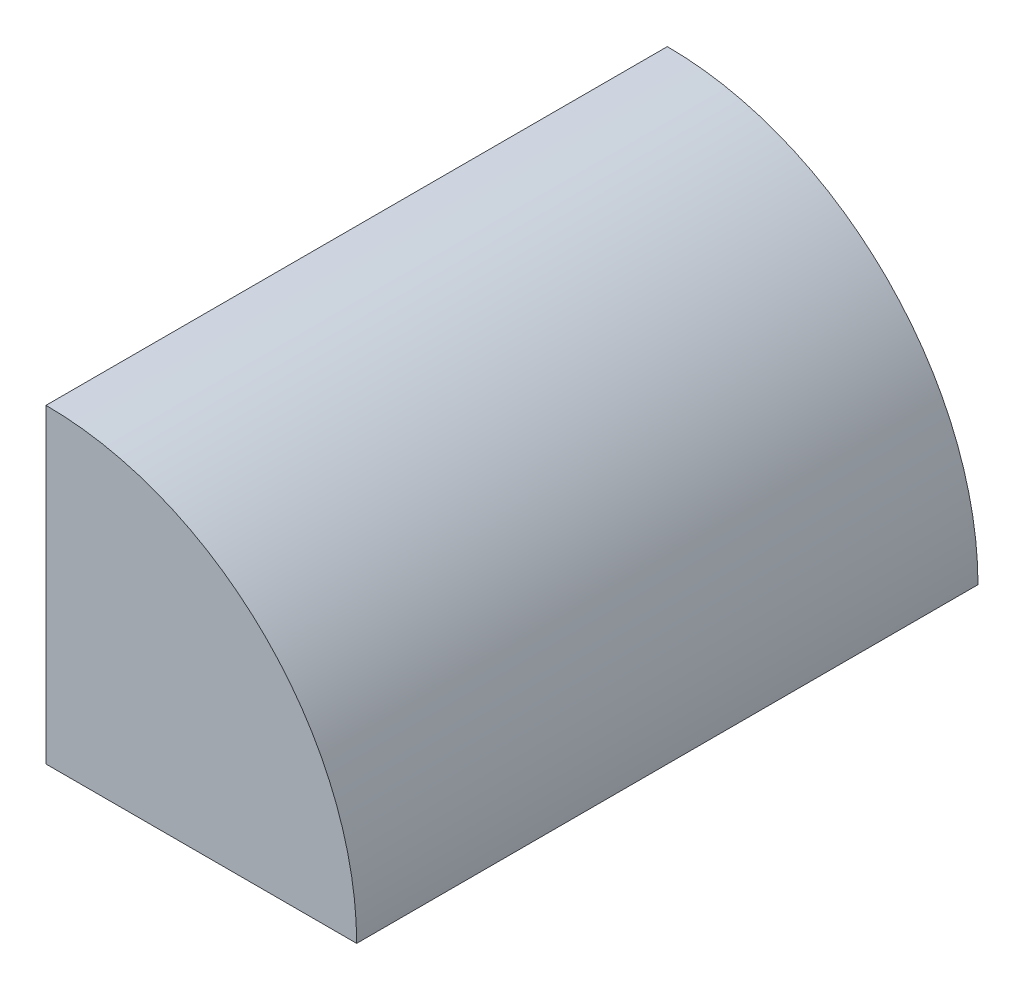
from build123d import *

# Parameters (mm, degrees)
SALIENTE_EXTRUIR1_DEPTH = 50
CROQUIS2_R              = 5
CORTAR_EXTRUIR1_DEPTH   = 10


with BuildPart() as part:
    # Croquis1 → Saliente-Extruir1 (new body)
    with BuildSketch(Plane.XY):
        with BuildLine():
            Line((0, 25), (0, 0))
            Line((0, 0), (25, 0))
            ThreePointArc((25, 0), (17.67766953, 17.67766953), (0, 25))
        make_face()
    extrude(amount=SALIENTE_EXTRUIR1_DEPTH)

    # Croquis2 → Cortar-Extruir1 (cut)
    with BuildSketch(Plane(origin=(0, 0, 0), x_dir=(-1, 0, 0), z_dir=(0, 0, -1))):
        with Locations((-10.822214473, 9.691532922)):
            Circle(CROQUIS2_R)
    extrude(amount=-CORTAR_EXTRUIR1_DEPTH, mode=Mode.SUBTRACT)


solid = part.part
